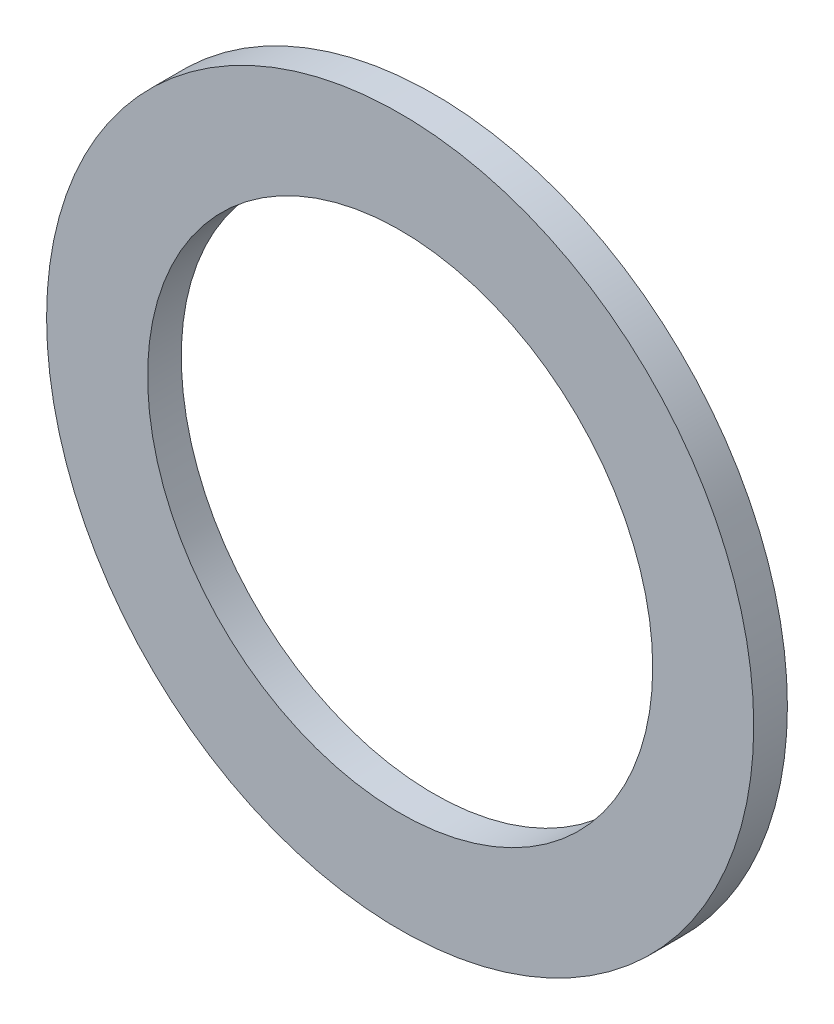
from build123d import *

# Parameters (mm, degrees)
SKETCH1_R           = 10.5
SKETCH1_R_2         = 7.5
BOSS_EXTRUDE1_DEPTH = 1


with BuildPart() as part:
    # Sketch1 → Boss-Extrude1 (new body)
    with BuildSketch(Plane.XY):
        Circle(SKETCH1_R)
        Circle(SKETCH1_R_2, mode=Mode.SUBTRACT)
    extrude(amount=BOSS_EXTRUDE1_DEPTH)


solid = part.part
